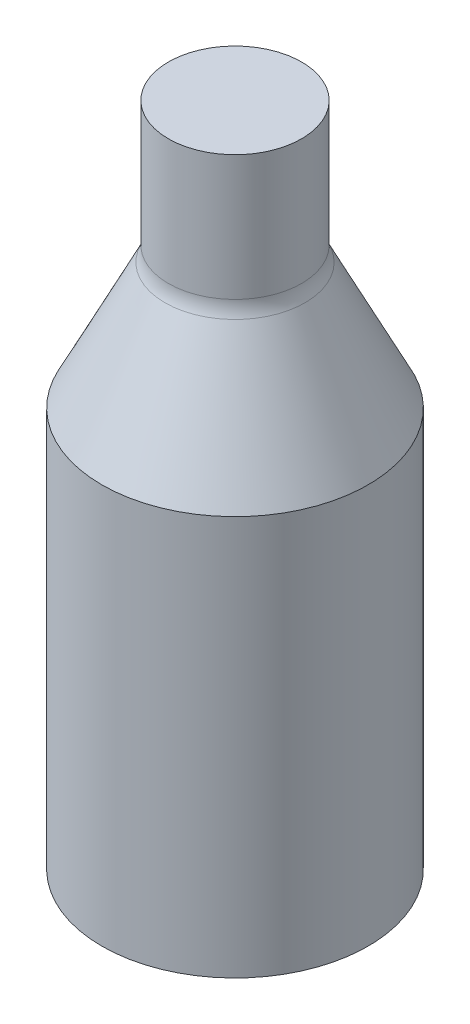
from build123d import *


with BuildPart() as part:
    # Sketch1 → Revolve1 (revolve)
    with BuildSketch(Plane.XY, mode=Mode.PRIVATE) as revolve1_sk:
        with BuildLine():
            Line((0, 0), (0, 100))
            Line((0, 100), (10, 100))
            Line((10, 100), (10, 81.180339887))
            ThreePointArc((10, 81.180339887), (10.133755053, 80.031575285), (10.527864045, 78.94427191))
            Line((10.527864045, 78.94427191), (20, 60))
            Line((20, 60), (20, 0))
            Line((20, 0), (0, 0))
        make_face()
    revolve(revolve1_sk.sketch.rotate(Axis((0, 109.571909523, 0), (0, -1, 0)), 90), axis=Axis((0, 109.571909523, 0), (0, -1, 0)))


solid = part.part
